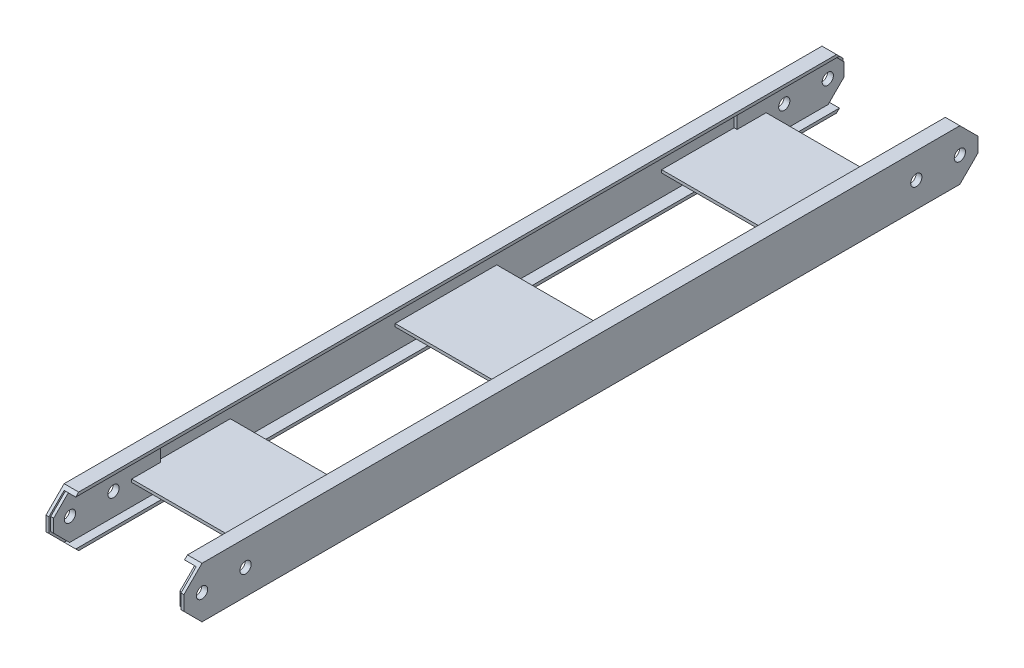
from build123d import *

# Parameters (mm, degrees)
EXTRUDE_1_DEPTH     = 2189
SKETCH_2_R          = 15.5
CUT_EXTRUDE_3_DEPTH = 2191.48419305
EXTRUDE_4_DEPTH     = 8
SKETCH_2_6_R        = 15.5
CUT_EXTRUDE_5_DEPTH = 2191.48419305
SKETCH_2_7_W        = 280
SKETCH_2_7_H        = 8
EXTRUDE_6_DEPTH     = 190


with BuildPart() as part:
    # 草图1 → 拉伸1 (new body)
    with BuildSketch(Plane.XY):
        Polygon((-150, 70), (-190, 70), (-190, -70), (-150, -70), (-150, -62), (-182, -62), (-182, 62), (-150, 62), align=None)
    extrude(amount=EXTRUDE_1_DEPTH)

    # 草图2 → 拉伸3 (cut, through all)
    with BuildSketch(Plane.ZY.offset(190)):
        with Locations((50, 0)):
            Circle(SKETCH_2_R)
        with Locations((170, 0)):
            Circle(SKETCH_2_R)
        with Locations((2019, 0)):
            Circle(SKETCH_2_R)
        with Locations((2139, 0)):
            Circle(SKETCH_2_R)
        Polygon((50, 70), (0, 20), (0, 70), align=None)
        Polygon((50, -70), (0, -20), (0, -70), align=None)
        Polygon((2189, -70), (2139, -70), (2189, -20), align=None)
        Polygon((2189, 70), (2139, 70), (2189, 20), align=None)
    extrude(amount=-CUT_EXTRUDE_3_DEPTH, mode=Mode.SUBTRACT)

    # 草图3 → 拉伸4 (add)
    with BuildSketch(Plane(origin=(-182, 0, 0), x_dir=(0, 0, -1), z_dir=(1, 0, 0))):
        Polygon((-2184, -17.928932188), (-2184, 17.928932188), (-2139.928932188, 62), (-1889, 62), (-1889, -62), (-2139.928932188, -62), align=None)
        Polygon((-5, -17.928932188), (-49.071067812, -62), (-300, -62), (-300, 62), (-49.071067812, 62), (-5, 17.928932188), align=None)
    extrude(amount=EXTRUDE_4_DEPTH)

    # 草图2<6> → 拉伸5 (cut, through all)
    with BuildSketch(Plane.ZY.offset(190)):
        with Locations((50, 0)):
            Circle(SKETCH_2_6_R)
        with Locations((170, 0)):
            Circle(SKETCH_2_6_R)
        with Locations((2019, 0)):
            Circle(SKETCH_2_6_R)
        with Locations((2139, 0)):
            Circle(SKETCH_2_6_R)
    extrude(amount=-CUT_EXTRUDE_5_DEPTH, mode=Mode.SUBTRACT)

    # 草图2<7> → 拉伸6 (add)
    with BuildSketch(Plane.ZY.offset(190)):
        with Locations((1094.5, 0)):
            Rectangle(SKETCH_2_7_W, SKETCH_2_7_H)
        with Locations((360, 0)):
            Rectangle(SKETCH_2_7_W, SKETCH_2_7_H)
        with Locations((1829, 0)):
            Rectangle(SKETCH_2_7_W, SKETCH_2_7_H)
    extrude(amount=-EXTRUDE_6_DEPTH)

    # 镜向1: part across plane


with BuildPart() as part_1:
    add(part.part)
    add(part.part.mirror(Plane(origin=(0, -4, 1689), x_dir=(0, 0, 1), z_dir=(-1, 0, 0))))


solid = part_1.part
